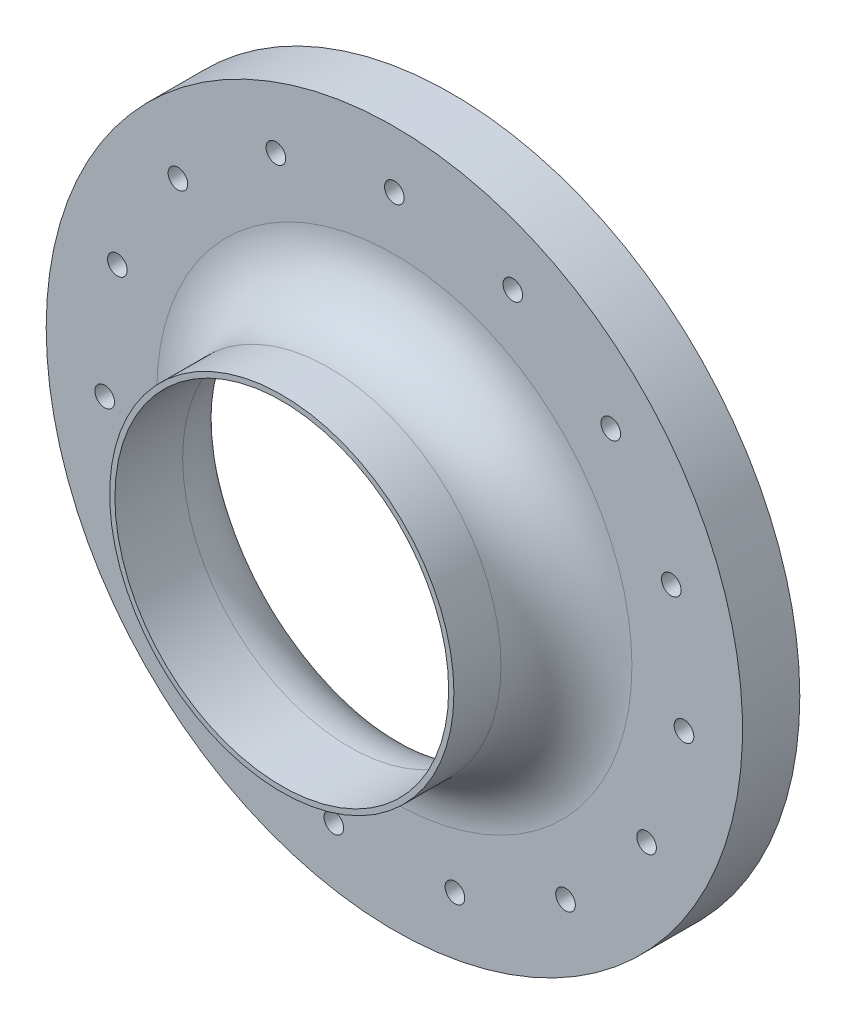
from build123d import *

# Parameters (mm, degrees)
ESQUISSE2_R                  = 1.5
ENL_V_MAT_EXTRU_1_DEPTH      = 83.632227369
ESQUISSE3_R                  = 1
ENL_V_MAT_EXTRU_2_DEPTH      = 3
R_P_TITION_CIRCULAIRE1_COUNT = 4
SKETCH1_R                    = 57.15
SKETCH1_R_2                  = 53.2
CUT_EXTRUDE1_DEPTH           = 88.2243372


with BuildPart() as part:
    # Esquisse1 → Base-Révolution (revolve)
    with BuildSketch(Plane(origin=(0, 0, 0), x_dir=(0, 0, -1), z_dir=(1, 0, 0)), mode=Mode.PRIVATE) as base_r_volution_sk:
        with BuildLine():
            Line((0, 25.5), (0, 26.3))
            Line((0, 26.3), (7.2, 26.3))
            ThreePointArc((7.2, 26.3), (14.271067812, 29.228932188), (17.2, 36.3))
            Line((17.2, 36.3), (17.2, 56))
            Line((17.2, 56), (22, 56))
            Line((22, 56), (22, 57.15))
            Line((22, 57.15), (32.8, 57.15))
            Line((32.8, 57.15), (32.8, 54.6))
            Line((32.8, 54.6), (27.8, 54.6))
            Line((27.8, 54.6), (27.8, 53.45))
            ThreePointArc((27.8, 53.45), (22.885607871, 51.414392129), (20.85, 46.5))
            Line((20.85, 46.5), (20.85, 36))
            ThreePointArc((20.85, 36), (17.774621202, 28.575378798), (10.35, 25.5))
            Line((10.35, 25.5), (1.5, 25.5))
            Line((1.5, 25.5), (0, 25.5))
        make_face()
    revolve(base_r_volution_sk.sketch.rotate(Axis((0, 0, 0), (0, 0, -1)), 90), axis=Axis((0, 0, 0), (0, 0, -1)))

    # Esquisse2 → Enlèv. mat.-Extru.1 (cut, through all)
    with BuildSketch(Plane.XY.offset(-17.2)):
        with Locations((0, 44.5)):
            Circle(ESQUISSE2_R)
        with Locations((18.099780617, 40.652772865)):
            Circle(ESQUISSE2_R)
        with Locations((33.069944734, 29.776311983)):
            Circle(ESQUISSE2_R)
        with Locations((42.322014975, 13.75125625)):
            Circle(ESQUISSE2_R)
        with Locations((44.256224344, -4.651516615)):
            Circle(ESQUISSE2_R)
        with Locations((38.538130468, -22.25)):
            Circle(ESQUISSE2_R)
        with Locations((26.156443727, -36.00125625)):
            Circle(ESQUISSE2_R)
        with Locations((9.252070241, -43.527568233)):
            Circle(ESQUISSE2_R)
        with Locations((-9.252070241, -43.527568233)):
            Circle(ESQUISSE2_R)
        with Locations((-26.156443727, -36.00125625)):
            Circle(ESQUISSE2_R)
        with Locations((-38.538130468, -22.25)):
            Circle(ESQUISSE2_R)
        with Locations((-44.256224344, -4.651516615)):
            Circle(ESQUISSE2_R)
        with Locations((-42.322014975, 13.75125625)):
            Circle(ESQUISSE2_R)
        with Locations((-33.069944734, 29.776311983)):
            Circle(ESQUISSE2_R)
        with Locations((-18.099780617, 40.652772865)):
            Circle(ESQUISSE2_R)
    extrude(amount=-ENL_V_MAT_EXTRU_1_DEPTH, mode=Mode.SUBTRACT)

    # Esquisse3 → Enlèv. mat.-Extru.2 (cut)
    with BuildSketch(Plane(origin=(0, 57.5, 0), x_dir=(-1, 0, 0), z_dir=(0, 1, 0))):
        with Locations(Location((0, -19.5, 0), (0, 0, 90))):
            Circle(ESQUISSE3_R)
    enl_v_mat_extru_2 = extrude(amount=-ENL_V_MAT_EXTRU_2_DEPTH, mode=Mode.SUBTRACT)

    # Répétition circulaire1: Enlèv. mat.-Extru.2 ×4 about axis
    r_p_tition_circulaire1_axis = Axis((0, 0, 0), (0, 0, 1))
    for i in range(1, R_P_TITION_CIRCULAIRE1_COUNT):
        add(enl_v_mat_extru_2.rotate(r_p_tition_circulaire1_axis, i * 360 / R_P_TITION_CIRCULAIRE1_COUNT), mode=Mode.SUBTRACT)

    # Sketch1 → Cut-Extrude1 (cut, through all)
    with BuildSketch(Plane(origin=(0, 0, -32.8), x_dir=(-1, 0, 0), z_dir=(0, 0, -1))):
        Circle(SKETCH1_R)
        Circle(SKETCH1_R_2, mode=Mode.SUBTRACT)
    extrude(amount=-CUT_EXTRUDE1_DEPTH, mode=Mode.SUBTRACT)


solid = part.part
